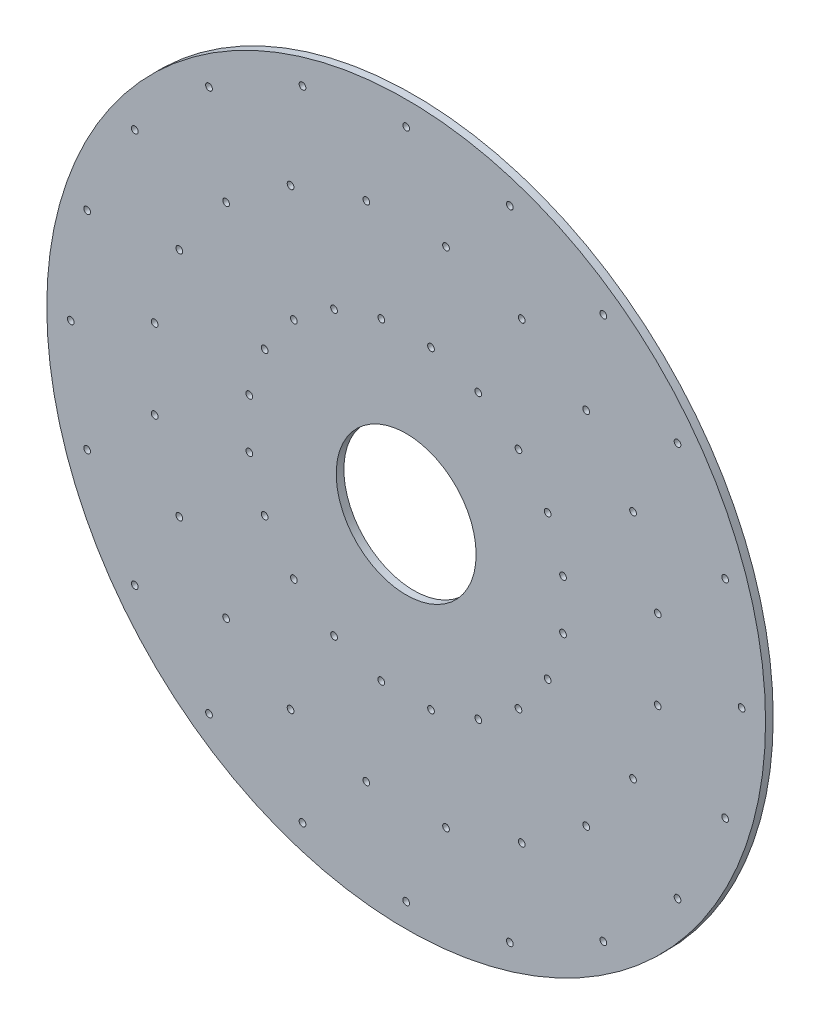
from build123d import *

# Parameters (mm, degrees)
SKETCH1_R           = 187.5
BOSS_EXTRUDE1_DEPTH = 4
SKETCH2_R           = 36.5
CUT_EXTRUDE1_DEPTH  = 266.195211118
SKETCH3_R           = 1.755
CUT_EXTRUDE2_DEPTH  = 266.195211118
CIRPATTERN1_COUNT   = 20
SKETCH4_R           = 1.755
CUT_EXTRUDE3_DEPTH  = 266.195211118
CIRPATTERN2_COUNT   = 20


with BuildPart() as part:
    # Sketch1 → Boss-Extrude1 (new body)
    with BuildSketch(Plane.XY):
        Circle(SKETCH1_R)
    extrude(amount=BOSS_EXTRUDE1_DEPTH)

    # Sketch2 → Cut-Extrude1 (cut, through all)
    with BuildSketch(Plane.XY.offset(4)):
        Circle(SKETCH2_R)
    extrude(amount=-CUT_EXTRUDE1_DEPTH, mode=Mode.SUBTRACT)

    # Sketch3 → Cut-Extrude2 (cut, through all)
    with BuildSketch(Plane.XY.offset(4)):
        with Locations((0, 175)):
            Circle(SKETCH3_R)
    cut_extrude2 = extrude(amount=-CUT_EXTRUDE2_DEPTH, mode=Mode.SUBTRACT)

    # CirPattern1: Cut-Extrude2 ×20 about axis
    cirpattern1_axis = Axis((0, 0, -0.2), (0, 0, 1))
    for i in range(1, CIRPATTERN1_COUNT):
        add(cut_extrude2.rotate(cirpattern1_axis, i * 360 / CIRPATTERN1_COUNT), mode=Mode.SUBTRACT)

    # Sketch4 → Cut-Extrude3 (cut, through all)
    with BuildSketch(Plane.XY.offset(4)):
        with Locations((20.781608406, 131.209911552)):
            Circle(SKETCH4_R)
        with Locations((12.959885154, 81.825494522)):
            Circle(SKETCH4_R)
    cut_extrude3 = extrude(amount=-CUT_EXTRUDE3_DEPTH, mode=Mode.SUBTRACT)

    # CirPattern2: Cut-Extrude3 ×20 about axis
    cirpattern2_axis = Axis((0, 0, -0.2), (0, 0, 1))
    for i in range(1, CIRPATTERN2_COUNT):
        add(cut_extrude3.rotate(cirpattern2_axis, i * 360 / CIRPATTERN2_COUNT), mode=Mode.SUBTRACT)


solid = part.part
